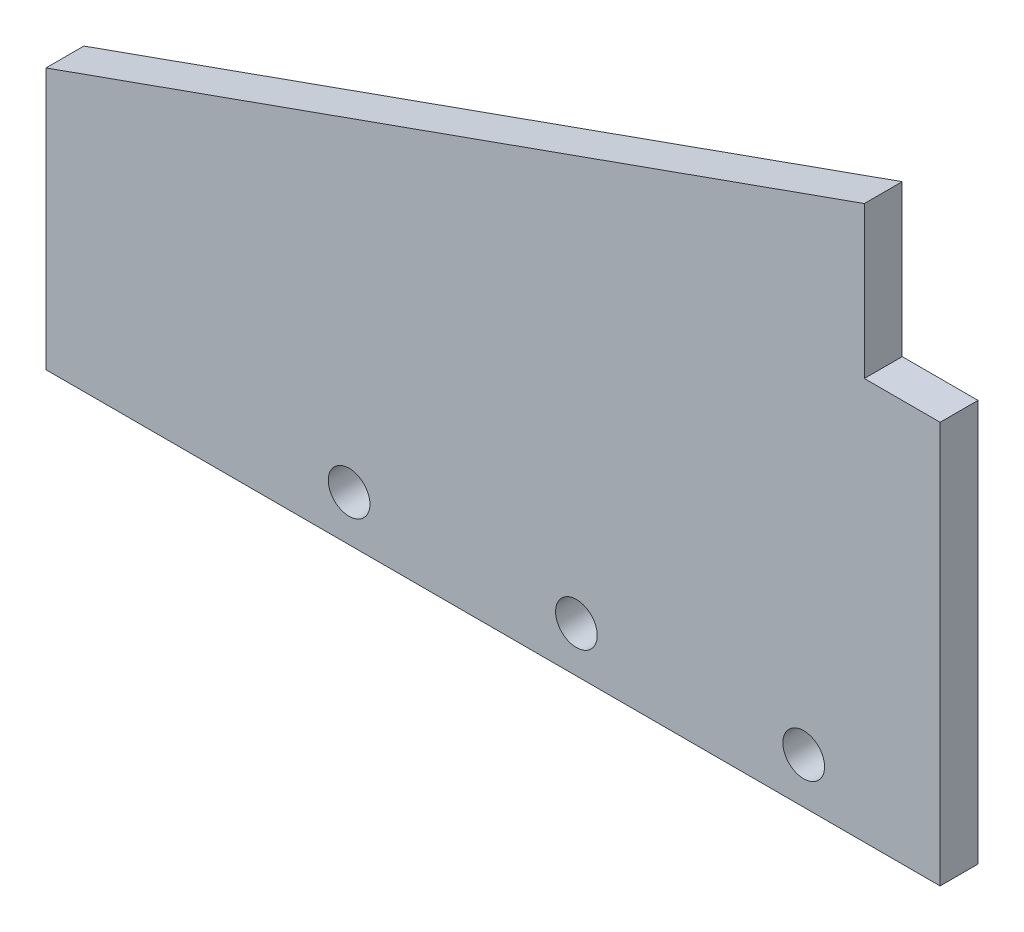
from build123d import *

# Parameters (mm, degrees)
RESSALTO_EXTRUS_O1_DEPTH = 5
FURO_COM_FOLGA_DE_M51_D  = 5.5


with BuildPart() as part:
    # Esboço1 → Ressalto-extrusão1 (new body)
    with BuildSketch(Plane.XY):
        Polygon((0, 0), (0, 34.5), (108, 73), (108, 53), (118, 53), (118, 0), align=None)
    extrude(amount=RESSALTO_EXTRUS_O1_DEPTH)

    # Furo com folga de M51 (through all)
    with Locations(Plane.XY.offset(5)):
        with Locations((100, 6), (70, 6), (40, 6)):
            Hole(FURO_COM_FOLGA_DE_M51_D / 2)


solid = part.part
